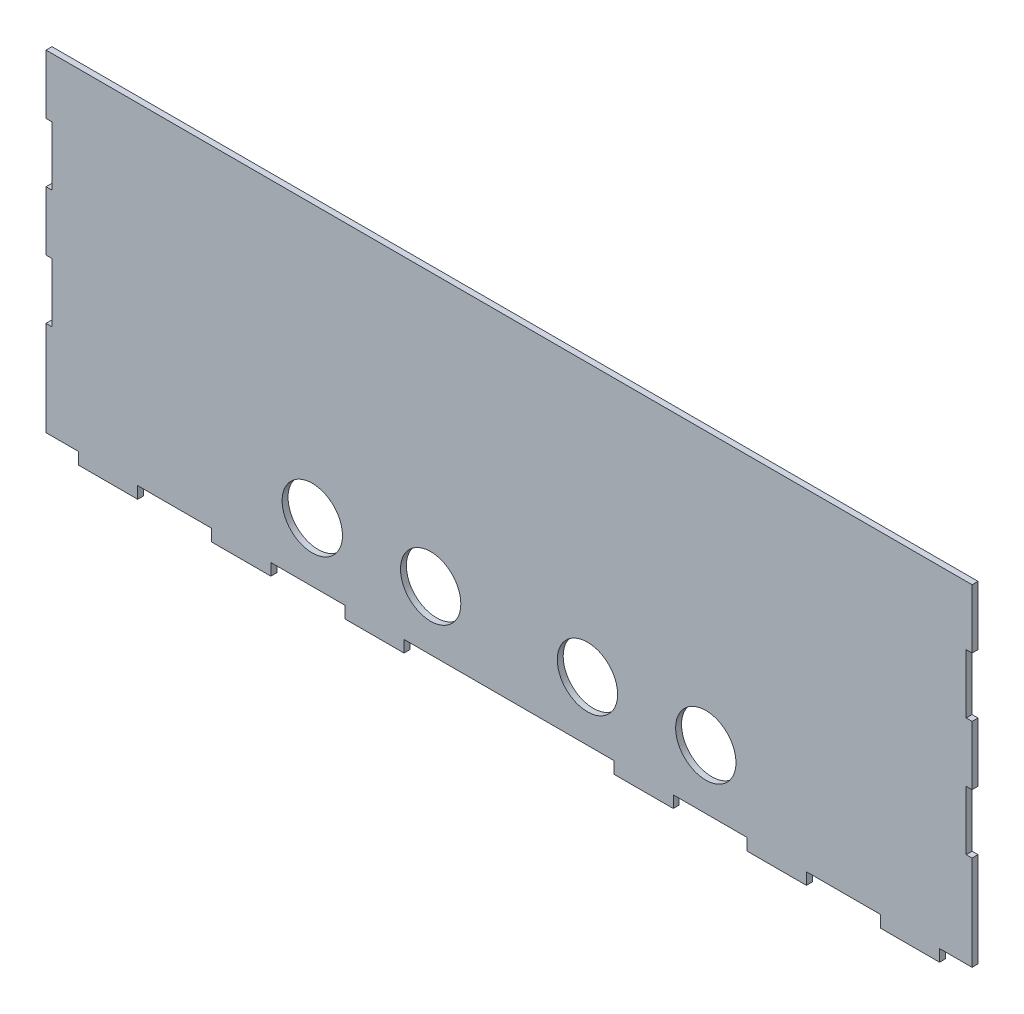
from build123d import *

# Parameters (mm, degrees)
SKETCH1_R               = 10.2
BOSS_EXTRUDE1_DEPTH     = 2
CUT_EXTRUDE4_DEPTH      = 168.619360457
CUT_EXTRUDE4_DEPTH_BACK = 168.619360457
SKETCH5_W               = 20
SKETCH5_H               = 2


with BuildPart() as part:
    # Sketch1 → Boss-Extrude1 (new body)
    with BuildSketch(Plane.XY):
        Polygon((-156.5, -56), (-145.5, -56), (-145.5, -60), (-125.5, -60), (-125.5, -56), (-100.5, -56), (-100.5, -60), (-80.5, -60), (-80.5, -56), (-55.5, -56), (-55.5, -60), (-35.5, -60), (-35.5, -56), (35.5, -56), (35.5, -60), (55.5, -60), (55.5, -56), (80.5, -56), (80.5, -60), (100.5, -60), (100.5, -56), (125.5, -56), (125.5, -60), (145.5, -60), (145.5, -56), (156.5, -56), (156.5, -24), (154.5, -24), (154.5, -4), (156.5, -4), (156.5, 16), (154.5, 16), (154.5, 36), (156.5, 36), (156.5, 56), (145.5, 56), (145.5, 58), (125.5, 58), (125.5, 56), (100.5, 56), (100.5, 58), (80.5, 58), (80.5, 56), (55.5, 56), (55.5, 58), (35.5, 58), (35.5, 56), (-35.5, 56), (-35.5, 58), (-55.5, 58), (-55.5, 56), (-80.5, 56), (-80.5, 58), (-100.5, 58), (-100.5, 56), (-125.5, 56), (-125.5, 58), (-145.5, 58), (-145.5, 56), (-156.5, 56), (-156.5, 36), (-154.5, 36), (-154.5, 16), (-156.5, 16), (-156.5, -4), (-154.5, -4), (-154.5, -24), (-156.5, -24), align=None)
        with Locations((-66.5, -36)):
            Circle(SKETCH1_R, mode=Mode.SUBTRACT)
        with Locations((-26.5, -36)):
            Circle(SKETCH1_R, mode=Mode.SUBTRACT)
        with Locations(Location((26.5, -36, 0), (0, 0, 180))):
            Circle(SKETCH1_R, mode=Mode.SUBTRACT)
        with Locations(Location((66.5, -36, 0), (0, 0, 180))):
            Circle(SKETCH1_R, mode=Mode.SUBTRACT)
    extrude(amount=BOSS_EXTRUDE1_DEPTH)

    # Sketch5 → Cut-Extrude4 (cut, two sides: drawn at the far end of the back side and taken through both)
    with BuildSketch(Plane.XY.offset(2).offset(-CUT_EXTRUDE4_DEPTH_BACK)):
        with Locations((-135.5, 57)):
            Rectangle(SKETCH5_W, SKETCH5_H)
        with Locations((-90.5, 57)):
            Rectangle(SKETCH5_W, SKETCH5_H)
        with Locations((-45.5, 57)):
            Rectangle(SKETCH5_W, SKETCH5_H)
        with Locations((45.5, 57)):
            Rectangle(SKETCH5_W, SKETCH5_H)
        with Locations((90.5, 57)):
            Rectangle(SKETCH5_W, SKETCH5_H)
        with Locations((135.5, 57)):
            Rectangle(SKETCH5_W, SKETCH5_H)
    extrude(amount=CUT_EXTRUDE4_DEPTH + CUT_EXTRUDE4_DEPTH_BACK, mode=Mode.SUBTRACT)


solid = part.part
